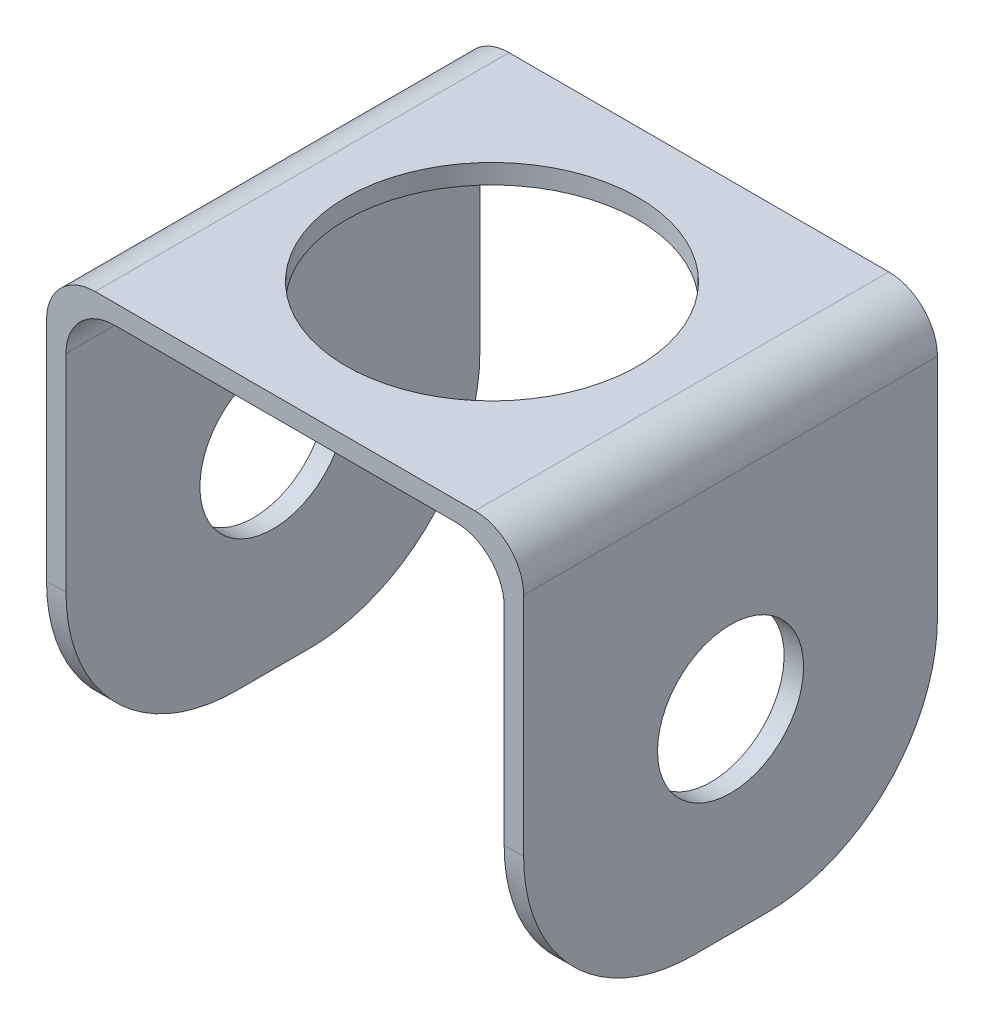
from build123d import *

# Parameters (mm, degrees)
EXTRUDE_1_DEPTH          = 170
SKETCH_2_R               = 60
CUT_EXTRUDE_1_DEPTH      = 180
CUT_EXTRUDE_2_DEPTH      = 313.955268369
CUT_EXTRUDE_2_DEPTH_BACK = 313.955268369
SKETCH_3_R               = 30
FILLET_1_R               = 70
FILLET_2_R               = 20
FILLET_3_R               = 20


with BuildPart() as part:
    # 草图1 → 凸台-拉伸1 (new body)
    with BuildSketch(Plane.XY):
        Polygon((-180, 0), (0, 0), (0, -175), (8, -175), (8, 8), (-180, 8), (-188, 8), (-188, -175), (-180, -175), align=None)
    extrude(amount=EXTRUDE_1_DEPTH)

    # 草图2 → 切除-拉伸1 (cut)
    with BuildSketch(Plane(origin=(0, 8, 0), x_dir=(1, 0, 0), z_dir=(0, 1, 0))):
        with Locations(Location((-90, -85, 0), (0, 0, 180))):
            Circle(SKETCH_2_R)
    extrude(amount=-CUT_EXTRUDE_1_DEPTH, mode=Mode.SUBTRACT)

    # 草图3 → 切除-拉伸2 (cut, two sides: drawn at the far end of the back side and taken through both)
    with BuildSketch(Plane(origin=(8, 0, 0), x_dir=(0, 0, -1), z_dir=(1, 0, 0)).offset(-CUT_EXTRUDE_2_DEPTH_BACK)):
        with Locations(Location((-85, -95, 0), (0, 0, 90))):
            Circle(SKETCH_3_R)
    extrude(amount=CUT_EXTRUDE_2_DEPTH + CUT_EXTRUDE_2_DEPTH_BACK, mode=Mode.SUBTRACT)

    # 圆角1
    fillet_1_edges = [part.edges().sort_by_distance(p)[0] for p in [
        (4, -175, 0),
        (4, -175, 170),
        (-184, -175, 170),
        (-184, -175, 0),
    ]]
    fillet(fillet_1_edges, radius=FILLET_1_R)

    # 圆角2
    fillet_2_edges = [part.edges().sort_by_distance(p)[0] for p in [
        (0, 0, 85),
        (-180, 0, 85),
    ]]
    fillet(fillet_2_edges, radius=FILLET_2_R)

    # 圆角3
    fillet_3_edges = [part.edges().sort_by_distance(p)[0] for p in [
        (-188, 8, 85),
        (8, 8, 85),
    ]]
    fillet(fillet_3_edges, radius=FILLET_3_R)


solid = part.part
